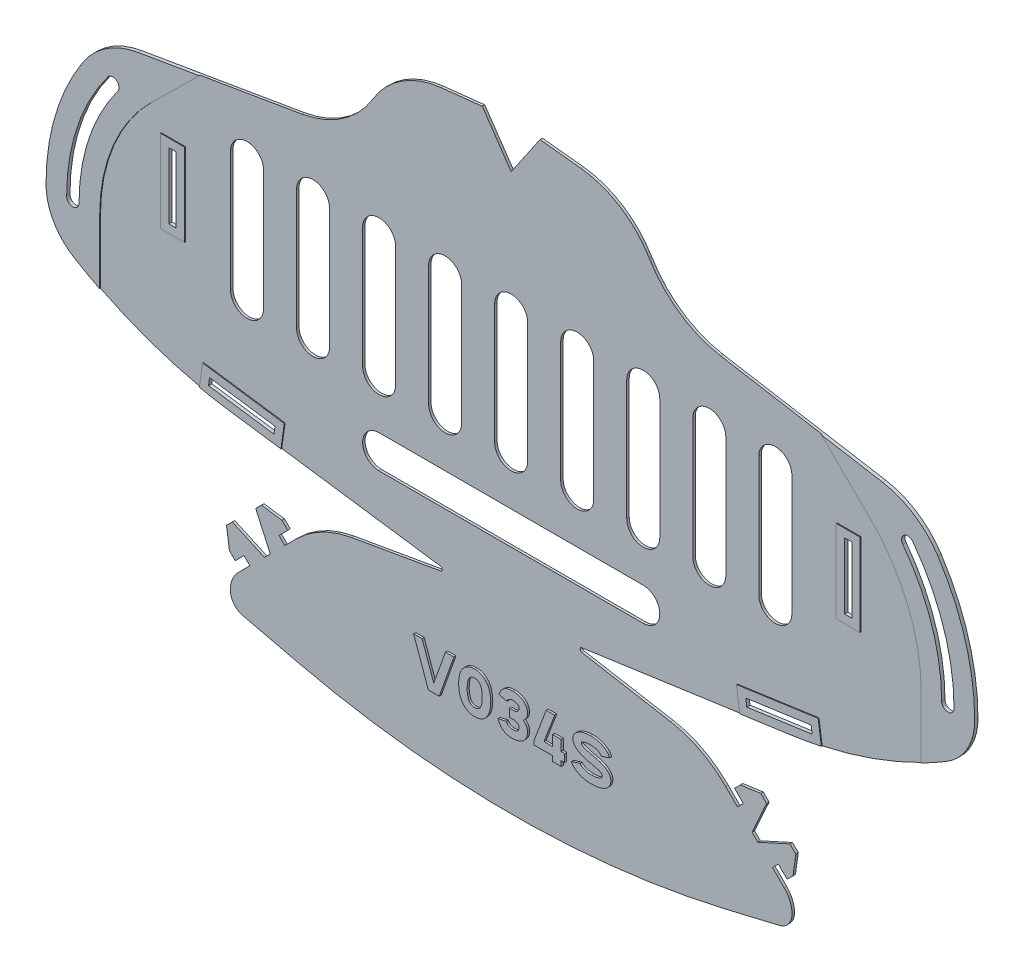
from build123d import *

# Parameters (mm, degrees)
MAIN_SHAPE_DEPTH                   = 0.6
ELASTIC_ATTACHMENT_POINTS_DEPTH    = 184.525502315
REINFORCED_ATTACHMENT_POINTS_DEPTH = 0.2
TAB_SLITS_DEPTH                    = 184.525502315
REINFORCED_TAB_SLITS_DEPTH         = 0.2
TAB_FLEX_RELIEF_DEPTH              = 184.525502315
TAB_FLEX_RELIEF_DEPTH_BACK         = 184.525502315
BREATHING_SLITS_DEPTH              = 184.525502315
VERSION_NUMBER_DEPTH               = 0.5
FILLET1_R                          = 0.5
TAB_OVERLAY_SLIT_DEPTH             = 184.525502394
TAB_OVERLAY_SLIT_DEPTH_BACK        = 184.525502394
SKETCH12_W                         = 1.8
SKETCH12_H                         = 16
SKETCH13_W                         = 5.8
SKETCH13_H                         = 20
SKETCH13_W_2                       = 1.8
SKETCH13_H_2                       = 16
TAB_OVERLAY_REINFORCEMENT_DEPTH    = 0.2


with BuildPart() as part:
    # Sketch1 → Main Shape (new body)
    with BuildSketch(Plane.XY):
        with BuildLine():
            Line((0, -10.235233266), (-7, 0))
            Line((-7, 0), (-16.941855461, -1.076805455))
            ThreePointArc((-16.941855461, -1.076805455), (-26.448172688, -4.42923559), (-33.461443341, -11.669600897))
            ThreePointArc((-33.461443341, -11.669600897), (-40.804108255, -19.481824954), (-50.74391922, -23.5))
            Line((-50.74391922, -23.5), (-90.180351554, -30.190874742))
            ThreePointArc((-90.180351554, -30.190874742), (-97.811505455, -33.190405434), (-103.597722286, -39))
            ThreePointArc((-103.597722286, -39), (-110.227482046, -53.35351039), (-112.5, -69))
            ThreePointArc((-112.5, -69), (-110.685143325, -75.893640703), (-105.711102551, -81))
            ThreePointArc((-105.711102551, -81), (-87.655491519, -89.524485559), (-68.266232563, -94.291935705))
            Line((-68.266232563, -94.291935705), (-14, -102))
            Line((-14, -102), (-38.626554922, -106.304973016))
            ThreePointArc((-38.626554922, -106.304973016), (-45.849449199, -108.748014338), (-52, -113.254607005))
            Line((-52, -113.254607005), (-54.828307349, -116.0831539))
            Line((-54.828307349, -116.0831539), (-56.242580797, -114.669000226))
            Line((-56.242580797, -114.669000226), (-54.121350285, -112.547590054))
            Line((-54.121350285, -112.547590054), (-55.535623732, -111.13343638))
            Line((-55.535623732, -111.13343638), (-60.48540114, -110.426539202))
            Line((-60.48540114, -110.426539202), (-68.970323187, -118.912179887))
            Line((-68.970323187, -118.912179887), (-68.263006804, -123.861897408))
            Line((-68.263006804, -123.861897408), (-66.848733357, -125.276051082))
            Line((-66.848733357, -125.276051082), (-64.727502845, -123.154640911))
            Line((-64.727502845, -123.154640911), (-63.313229397, -124.568794586))
            Line((-63.313229397, -124.568794586), (-66.141536747, -127.397341481))
            ThreePointArc((-66.141536747, -127.397341481), (-67.550417669, -129.506025763), (-68.045148042, -131.993340924))
            ThreePointArc((-68.045148042, -131.993340924), (-67.183295285, -134.473669911), (-64.9691321, -135.885159709))
            Line((-64.9691321, -135.885159709), (-52.436095294, -138.860716087))
            ThreePointArc((-52.436095294, -138.860716087), (-26.397134772, -143.459954927), (0, -145))
            ThreePointArc((0, -145), (26.397134772, -143.459954927), (52.436095294, -138.860716087))
            Line((52.436095294, -138.860716087), (64.9691321, -135.885159709))
            ThreePointArc((64.9691321, -135.885159709), (67.183295285, -134.473669911), (68.045148042, -131.993340924))
            ThreePointArc((68.045148042, -131.993340924), (67.550417669, -129.506025763), (66.141536747, -127.397341481))
            Line((66.141536747, -127.397341481), (63.313229397, -124.568794586))
            Line((63.313229397, -124.568794586), (64.727502845, -123.154640911))
            Line((64.727502845, -123.154640911), (66.848733357, -125.276051082))
            Line((66.848733357, -125.276051082), (68.263006804, -123.861897408))
            Line((68.263006804, -123.861897408), (68.970323187, -118.912179887))
            Line((68.970323187, -118.912179887), (60.48540114, -110.426539202))
            Line((60.48540114, -110.426539202), (55.535623732, -111.13343638))
            Line((55.535623732, -111.13343638), (54.121350285, -112.547590054))
            Line((54.121350285, -112.547590054), (56.242580797, -114.669000226))
            Line((56.242580797, -114.669000226), (54.828307349, -116.0831539))
            Line((54.828307349, -116.0831539), (52, -113.254607005))
            ThreePointArc((52, -113.254607005), (45.849449199, -108.748014338), (38.626554922, -106.304973016))
            Line((38.626554922, -106.304973016), (14, -102))
            Line((14, -102), (68.266232563, -94.291935705))
            ThreePointArc((68.266232563, -94.291935705), (87.655491519, -89.524485559), (105.711102551, -81))
            ThreePointArc((105.711102551, -81), (110.685143325, -75.893640703), (112.5, -69))
            ThreePointArc((112.5, -69), (110.227482046, -53.35351039), (103.597722286, -39))
            ThreePointArc((103.597722286, -39), (97.811505455, -33.190405434), (90.180351554, -30.190874742))
            Line((90.180351554, -30.190874742), (50.74391922, -23.5))
            ThreePointArc((50.74391922, -23.5), (40.804108255, -19.481824954), (33.461443341, -11.669600897))
            ThreePointArc((33.461443341, -11.669600897), (26.448172688, -4.42923559), (16.941855461, -1.076805455))
            Line((16.941855461, -1.076805455), (7, 0))
            Line((7, 0), (0, -10.235233266))
        make_face()
    extrude(amount=MAIN_SHAPE_DEPTH)

    # Sketch2 → Elastic Attachment Points (cut, through all)
    with BuildSketch(Plane.XY.offset(0.6)):
        with BuildLine():
            ThreePointArc((-97.5, -39), (-104.934164903, -53.188611699), (-107.5, -69))
            ThreePointArc((-107.5, -69), (-106, -70.5), (-104.5, -69))
            ThreePointArc((-104.5, -69), (-102.088115008, -54.137294997), (-95.1, -40.8))
            ThreePointArc((-95.1, -40.8), (-95.4, -38.7), (-97.5, -39))
        make_face()
        with BuildLine():
            ThreePointArc((97.5, -39), (104.934164903, -53.188611699), (107.5, -69))
            ThreePointArc((107.5, -69), (106, -70.5), (104.5, -69))
            ThreePointArc((104.5, -69), (102.088115008, -54.137294997), (95.1, -40.8))
            ThreePointArc((95.1, -40.8), (95.4, -38.7), (97.5, -39))
        make_face()
    extrude(amount=-ELASTIC_ATTACHMENT_POINTS_DEPTH, mode=Mode.SUBTRACT)

    # Sketch7 → Reinforced Attachment Points (add)
    # profile 1 of 2: a face of its own
    with BuildSketch(Plane.XY.offset(0.6)):
        with BuildLine():
            Line((-99.5, -69), (-99.5, -84.438405623))
            ThreePointArc((-99.5, -84.438405623), (-102.636073846, -82.774338486), (-105.711102551, -81))
            ThreePointArc((-105.711102551, -81), (-110.685143325, -75.893640703), (-112.5, -69))
            ThreePointArc((-112.5, -69), (-110.227482046, -53.35351039), (-103.597722286, -39))
            ThreePointArc((-103.597722286, -39), (-97.811505455, -33.190405434), (-90.180351554, -30.190874742))
            Line((-90.180351554, -30.190874742), (-75.331937335, -27.671659038))
            Line((-75.331937335, -27.671659038), (-86.893876913, -39))
            ThreePointArc((-86.893876913, -39), (-96.22042633, -52.729517991), (-99.5, -69))
        make_face()
        with BuildLine():
            ThreePointArc((-107.5, -69), (-106, -70.5), (-104.5, -69))
            ThreePointArc((-104.5, -69), (-102.088115008, -54.137294997), (-95.1, -40.8))
            ThreePointArc((-95.1, -40.8), (-95.4, -38.7), (-97.5, -39))
            ThreePointArc((-97.5, -39), (-104.934164903, -53.188611699), (-107.5, -69))
        make_face(mode=Mode.SUBTRACT)
    # profile 2 of 2: a face of its own
    with BuildSketch(Plane.XY.offset(0.6)):
        with BuildLine():
            Line((75.331937335, -27.671659038), (90.180351554, -30.190874742))
            ThreePointArc((90.180351554, -30.190874742), (97.811505455, -33.190405434), (103.597722286, -39))
            ThreePointArc((103.597722286, -39), (110.227482046, -53.35351039), (112.5, -69))
            ThreePointArc((112.5, -69), (110.685143325, -75.893640703), (105.711102551, -81))
            ThreePointArc((105.711102551, -81), (102.636073846, -82.774338486), (99.5, -84.438405623))
            Line((99.5, -84.438405623), (99.5, -69))
            ThreePointArc((99.5, -69), (96.22042633, -52.729517991), (86.893876913, -39))
            Line((86.893876913, -39), (75.331937335, -27.671659038))
        make_face()
        with BuildLine():
            ThreePointArc((104.5, -69), (106, -70.5), (107.5, -69))
            ThreePointArc((107.5, -69), (104.934164903, -53.188611699), (97.5, -39))
            ThreePointArc((97.5, -39), (95.4, -38.7), (95.1, -40.8))
            ThreePointArc((95.1, -40.8), (102.088115008, -54.137294997), (104.5, -69))
        make_face(mode=Mode.SUBTRACT)
    extrude(amount=REINFORCED_ATTACHMENT_POINTS_DEPTH)

    # Sketch6 → Tab Slits (cut, through all)
    with BuildSketch(Plane.XY.offset(0.6)):
        Polygon((-73.122472744, -91.582072346), (-57.281477317, -93.832153206), (-57.02834322, -92.050041221), (-72.869338647, -89.79996036), align=None)
        Polygon((73.122472744, -91.582072346), (72.869338647, -89.79996036), (57.02834322, -92.050041221), (57.281477317, -93.832153206), align=None)
    extrude(amount=-TAB_SLITS_DEPTH, mode=Mode.SUBTRACT)

    # Sketch9 → Reinforced Tab Slits (add)
    # profile 1 of 2: a face of its own
    with BuildSketch(Plane.XY.offset(0.6)):
        with BuildLine():
            Line((-55.582612996, -96.093537742), (-54.766958684, -90.3511769))
            Line((-54.766958684, -90.3511769), (-74.568202968, -87.538575825))
            Line((-74.568202968, -87.538575825), (-75.347469499, -93.024759795))
            ThreePointArc((-75.347469499, -93.024759795), (-71.81824936, -93.72204393), (-68.266232563, -94.291935705))
            Line((-68.266232563, -94.291935705), (-55.582612996, -96.093537742))
        make_face()
        Polygon((-57.281477317, -93.832153206), (-57.02834322, -92.050041221), (-72.869338647, -89.79996036), (-73.122472744, -91.582072346), align=None, mode=Mode.SUBTRACT)
    # profile 2 of 2: a face of its own
    with BuildSketch(Plane.XY.offset(0.6)):
        with BuildLine():
            Line((68.266232563, -94.291935705), (55.582612996, -96.093537742))
            Line((55.582612996, -96.093537742), (54.766958684, -90.3511769))
            Line((54.766958684, -90.3511769), (74.568202968, -87.538575825))
            Line((74.568202968, -87.538575825), (75.347469499, -93.024759795))
            ThreePointArc((75.347469499, -93.024759795), (71.81824936, -93.72204393), (68.266232563, -94.291935705))
        make_face()
        Polygon((57.02834322, -92.050041221), (72.869338647, -89.79996036), (73.122472744, -91.582072346), (57.281477317, -93.832153206), align=None, mode=Mode.SUBTRACT)
    extrude(amount=REINFORCED_TAB_SLITS_DEPTH)

    # Sketch11 → Tab Flex Relief (cut, two sides: drawn at the far end of the back side and taken through both)
    with BuildSketch(Plane.XY.offset(0.6).offset(-TAB_FLEX_RELIEF_DEPTH_BACK)):
        Polygon((-67.556169513, -117.49790644), (-59.777845211, -121.033110967), (-58.363691536, -119.618837519), (-61.899554814, -111.840812649), align=None)
        Polygon((61.899554814, -111.840812649), (67.556169513, -117.49790644), (59.777845211, -121.033110967), (58.363691536, -119.618837519), align=None)
    extrude(amount=TAB_FLEX_RELIEF_DEPTH + TAB_FLEX_RELIEF_DEPTH_BACK, mode=Mode.SUBTRACT)

    # Sketch3 → Breathing Slits (cut, through all)
    with BuildSketch(Plane.XY.offset(0.6)):
        with BuildLine():
            Line((4, -39.9), (4, -69))
            ThreePointArc((4, -69), (0, -73), (-4, -69))
            Line((-4, -69), (-4, -39.9))
            ThreePointArc((-4, -39.9), (0, -35.9), (4, -39.9))
        make_face()
        with BuildLine():
            Line((-12, -39.9), (-12, -69))
            ThreePointArc((-12, -69), (-16, -73), (-20, -69))
            Line((-20, -69), (-20, -39.9))
            ThreePointArc((-20, -39.9), (-16, -35.9), (-12, -39.9))
        make_face()
        with BuildLine():
            Line((-28, -39.9), (-28, -69))
            ThreePointArc((-28, -69), (-32, -73), (-36, -69))
            Line((-36, -69), (-36, -39.9))
            ThreePointArc((-36, -39.9), (-32, -35.9), (-28, -39.9))
        make_face()
        with BuildLine():
            Line((-32, -81), (32, -81))
            ThreePointArc((32, -81), (36, -85), (32, -89))
            Line((32, -89), (-32, -89))
            ThreePointArc((-32, -89), (-36, -85), (-32, -81))
        make_face()
        with BuildLine():
            Line((-44, -39.9), (-44, -69))
            ThreePointArc((-44, -69), (-48, -73), (-52, -69))
            Line((-52, -69), (-52, -39.9))
            ThreePointArc((-52, -39.9), (-48, -35.9), (-44, -39.9))
        make_face()
        with BuildLine():
            Line((-60, -39.9), (-60, -69))
            ThreePointArc((-60, -69), (-64, -73), (-68, -69))
            Line((-68, -69), (-68, -39.9))
            ThreePointArc((-68, -39.9), (-64, -35.9), (-60, -39.9))
        make_face()
        with BuildLine():
            Line((12, -39.9), (12, -69))
            ThreePointArc((12, -69), (16, -73), (20, -69))
            Line((20, -69), (20, -39.9))
            ThreePointArc((20, -39.9), (16, -35.9), (12, -39.9))
        make_face()
        with BuildLine():
            Line((28, -39.9), (28, -69))
            ThreePointArc((28, -69), (32, -73), (36, -69))
            Line((36, -69), (36, -39.9))
            ThreePointArc((36, -39.9), (32, -35.9), (28, -39.9))
        make_face()
        with BuildLine():
            Line((44, -39.9), (44, -69))
            ThreePointArc((44, -69), (48, -73), (52, -69))
            Line((52, -69), (52, -39.9))
            ThreePointArc((52, -39.9), (48, -35.9), (44, -39.9))
        make_face()
        with BuildLine():
            Line((60, -39.9), (60, -69))
            ThreePointArc((60, -69), (64, -73), (68, -69))
            Line((68, -69), (68, -39.9))
            ThreePointArc((68, -39.9), (64, -35.9), (60, -39.9))
        make_face()
    extrude(amount=-BREATHING_SLITS_DEPTH, mode=Mode.SUBTRACT)

    # Sketch8 → Version Number (add)
    # profile 1 of 5: a face of its own
    with BuildSketch(Plane.XY.offset(0.6)):
        Polygon((-19.57047323, -128.5), (-16.935552595, -128.5), (-13.364124024, -118.5), (-15.427616087, -118.5), (-18.253012913, -126.420634921), (-21.078409738, -118.5), (-23.141901802, -118.5), align=None)
    # profile 2 of 5: a face of its own
    with BuildSketch(Plane.XY.offset(0.6)):
        with BuildLine():
            add(Edge.make_bspline(
                [(-8.341949344, -118.5), (-8.486315308, -118.505695671), (-8.769070456, -118.51685121), (-9.182205457, -118.5745591), (-9.57004816, -118.680335178), (-9.937249736, -118.819656178), (-10.279525307, -119.003303471), (-10.603318482, -119.221085059), (-10.896329097, -119.487440084), (-11.17178415, -119.785519386), (-11.417647331, -120.12453761), (-11.63108304, -120.500892889), (-11.813045817, -120.912503383), (-11.961966981, -121.360169436), (-12.077516029, -121.844506854), (-12.165269968, -122.364485904), (-12.216824407, -122.921030718), (-12.227481137, -123.303893775), (-12.232959719, -123.500722112)],
                knots=[0, 0, 0, 0, 0.970159994, 1.900155169, 2.79438565, 3.665191596, 4.532301255, 5.397946305, 6.279238358, 7.185391655, 8.120220805, 9.085107467, 10.08639026, 11.138349125, 12.249459105, 13.427760297, 14.677622047, 16, 16, 16, 16], degree=3))
            add(Edge.make_bspline(
                [(-12.232959719, -123.500722112), (-12.227536328, -123.69832053), (-12.217027701, -124.081196856), (-12.165060632, -124.637697099), (-12.077614742, -125.156966907), (-11.961504885, -125.641884177), (-11.813562222, -126.090648826), (-11.631015597, -126.502814664), (-11.417705293, -126.879260377), (-11.171624113, -127.218032326), (-10.897232375, -127.51659595), (-10.601764829, -127.779877259), (-10.280413586, -128.000979952), (-9.937056282, -128.183632701), (-9.570503227, -128.324409639), (-9.181550148, -128.425104033), (-8.769771827, -128.488808035), (-8.486990454, -128.496221224), (-8.342846378, -128.5)],
                knots=[0, 0, 0, 0, 1.327400251, 2.57203543, 3.750234214, 4.861247624, 5.917991082, 6.919186852, 7.883989653, 8.818737555, 9.724812096, 10.602616666, 11.47109776, 12.338132057, 13.208862319, 14.101698703, 15.032365954, 16, 16, 16, 16], degree=3))
            add(Edge.make_bspline(
                [(-8.342846378, -128.5), (-8.19870671, -128.496210687), (-7.91593398, -128.488776824), (-7.504093566, -128.425221319), (-7.114671235, -128.323813307), (-6.747309757, -128.184839888), (-6.404920278, -128.000200623), (-6.083873871, -127.779984633), (-5.788475203, -127.516566079), (-5.514065403, -127.218040576), (-5.267984776, -126.879258594), (-5.054692034, -126.502813072), (-4.872070157, -126.090657611), (-4.724432419, -125.641847927), (-4.607119569, -125.157235462), (-4.524677423, -124.637275213), (-4.467021197, -124.081441513), (-4.459110829, -123.698369528), (-4.455029445, -123.500722112)],
                knots=[0, 0, 0, 0, 0.96765053, 1.898333634, 2.791185227, 3.666728435, 4.529238626, 5.397734515, 6.275554038, 7.181644014, 8.116407839, 9.081227075, 10.082439899, 11.139201358, 12.250233695, 13.427610983, 14.672766316, 16, 16, 16, 16], degree=3))
            add(Edge.make_bspline(
                [(-4.455029445, -123.500722112), (-4.459170275, -123.303845261), (-4.46722698, -122.920787111), (-4.524470959, -122.364907693), (-4.607219153, -121.844238468), (-4.723968789, -121.360205444), (-4.872586754, -120.912494629), (-5.054624571, -120.500894477), (-5.268042748, -120.124539393), (-5.513905343, -119.785511139), (-5.78937858, -119.487469991), (-6.082319788, -119.220977415), (-6.40580465, -119.004075275), (-6.747116298, -118.818455332), (-7.115126862, -118.680915067), (-7.503443494, -118.574534625), (-7.916292572, -118.516562336), (-8.198777403, -118.506550382), (-8.342846378, -118.501444225)],
                knots=[0, 0, 0, 0, 1.322391154, 2.572941942, 3.750582404, 4.861863084, 5.913983562, 6.915420183, 7.880455081, 8.815427849, 9.721720359, 10.603147806, 11.468925845, 12.331628829, 13.207367743, 14.101735605, 15.031873656, 16, 16, 16, 16], degree=3))
            Line((-8.342846378, -118.501444225), (-8.341949344, -118.5))
        make_face()
        with BuildLine():
            add(Edge.make_bspline(
                [(-8.341949344, -126.579365079), (-8.411268892, -126.580142247), (-8.547279218, -126.581667111), (-8.744732455, -126.549518886), (-8.93118355, -126.50001124), (-9.105360845, -126.424863461), (-9.269156206, -126.32888552), (-9.419771749, -126.207295998), (-9.558130772, -126.063513987), (-9.68544583, -125.896932623), (-9.799317133, -125.703005633), (-9.897848122, -125.478827118), (-9.978585537, -125.222713054), (-10.047762295, -124.937433189), (-10.09901366, -124.621763618), (-10.137517225, -124.276117752), (-10.163383889, -123.899148475), (-10.166743164, -123.63702081), (-10.168489888, -123.500722112)],
                knots=[0, 0, 0, 0, 0.820209436, 1.609314487, 2.362064528, 3.101854642, 3.850272983, 4.605479342, 5.3882482, 6.210255141, 7.084711649, 8.047345167, 9.106040688, 10.263495908, 11.523832392, 12.893430008, 14.384674726, 16, 16, 16, 16], degree=3))
            add(Edge.make_bspline(
                [(-10.168489888, -123.500722112), (-10.166736277, -123.364424703), (-10.163363758, -123.102299516), (-10.137588113, -122.725313211), (-10.098695139, -122.378974061), (-10.048398855, -122.063111109), (-9.978181432, -121.778059679), (-9.8978784, -121.522619394), (-9.79934824, -121.298401339), (-9.685313581, -121.104640769), (-9.558923277, -120.937923887), (-9.418960791, -120.796456824), (-9.269240039, -120.674830172), (-9.105400155, -120.578630118), (-8.930754135, -120.50465551), (-8.745386588, -120.450210023), (-8.547242879, -120.423926373), (-8.411799607, -120.422146526), (-8.342846378, -120.421240419)],
                knots=[0, 0, 0, 0, 1.616177311, 3.108208617, 4.478528655, 5.748482895, 6.897727805, 7.956981757, 8.920123036, 9.795040793, 10.617481319, 11.394165711, 12.149770419, 12.898583529, 13.63876386, 14.394368568, 15.182584207, 16, 16, 16, 16], degree=3))
            add(Edge.make_bspline(
                [(-8.342846378, -120.421240419), (-8.273894743, -120.422149219), (-8.138454599, -120.423934355), (-7.940288378, -120.450179948), (-7.755001791, -120.504762296), (-7.580668444, -120.577982734), (-7.418443109, -120.675595023), (-7.268973351, -120.796360516), (-7.129073104, -120.937948802), (-7.002708792, -121.104645093), (-6.888484055, -121.298351736), (-6.790698774, -121.523063414), (-6.706738916, -121.777554553), (-6.637549817, -122.063195246), (-6.586920138, -122.378948588), (-6.548128024, -122.725320897), (-6.52232236, -123.102297333), (-6.518954209, -123.364423957), (-6.517202869, -123.500722112)],
                knots=[0, 0, 0, 0, 0.817669415, 1.606129616, 2.361968767, 3.102378757, 3.843623451, 4.599462602, 5.376387978, 6.199083685, 7.074272906, 8.037713021, 9.100132017, 10.249733507, 11.520081779, 12.89082699, 14.383321233, 16, 16, 16, 16], degree=3))
            add(Edge.make_bspline(
                [(-6.517202869, -123.500722112), (-6.518947322, -123.637021556), (-6.52230223, -123.899150658), (-6.548198906, -124.276110066), (-6.586601856, -124.621789015), (-6.638185075, -124.937349474), (-6.70632694, -125.223220708), (-6.790728452, -125.478383327), (-6.888515307, -125.703055181), (-7.002576486, -125.896928348), (-7.129865628, -126.063488884), (-7.268161719, -126.207393621), (-7.418525808, -126.328120602), (-7.580707035, -126.425517476), (-7.754572285, -126.499891817), (-7.940941623, -126.549600883), (-8.138131252, -126.581404352), (-8.273829787, -126.580608552), (-8.342846378, -126.580203806)],
                knots=[0, 0, 0, 0, 1.616177474, 3.108208932, 4.478529109, 5.739530511, 6.897596372, 7.959685938, 8.922827315, 9.797745161, 10.620185771, 11.403367596, 12.15897238, 12.899987232, 13.640167639, 14.39331481, 15.182836171, 16, 16, 16, 16], degree=3))
            Line((-8.342846378, -126.580203806), (-8.341949344, -126.579365079))
        make_face(mode=Mode.SUBTRACT)
    # profile 3 of 5: a face of its own
    with BuildSketch(Plane.XY.offset(0.6)):
        with BuildLine():
            Line((0.980655463, -124.404761905), (1.075893558, -124.404761905))
            add(Edge.make_bspline(
                [(1.075893558, -124.404761905), (1.176161453, -124.411299477), (1.366796655, -124.423729091), (1.633462951, -124.486416557), (1.86625704, -124.578961335), (2.057944418, -124.709274647), (2.211589719, -124.861365804), (2.325917158, -125.032278467), (2.395578402, -125.222537651), (2.404453839, -125.355662585), (2.40893087, -125.422814713)],
                knots=[0, 0, 0, 0, 1.293250512, 2.458803691, 3.516087315, 4.504014474, 5.424976382, 6.287022232, 7.135923681, 8, 8, 8, 8], degree=3))
            add(Edge.make_bspline(
                [(2.40893087, -125.422814713), (2.40564132, -125.504440638), (2.399280334, -125.662280257), (2.330132962, -125.887718235), (2.211778105, -126.087113891), (2.076862268, -126.23073656), (1.947697612, -126.331172702), (1.832808617, -126.395688771), (1.703957717, -126.450185226), (1.560929711, -126.49595932), (1.404208252, -126.532200484), (1.233249315, -126.560253509), (1.047425593, -126.575366879), (0.918586597, -126.5785552), (0.851966971, -126.580203806)],
                knots=[0, 0, 0, 0, 1.334208421, 2.579951764, 3.816761299, 5.103436918, 5.78324123, 6.491044783, 7.25516555, 8.072210043, 8.94833879, 9.888551629, 10.908219533, 12, 12, 12, 12], degree=3))
            add(Edge.make_bspline(
                [(0.851966971, -126.580203806), (0.77757338, -126.579024673), (0.627088787, -126.576639503), (0.400442241, -126.537785365), (0.172167283, -126.472292557), (-0.054930116, -126.384048723), (-0.269086717, -126.26078738), (-0.446409245, -126.088542309), (-0.587579001, -125.87591894), (-0.642148155, -125.712337396), (-0.670550824, -125.62719493)],
                knots=[0, 0, 0, 0, 0.920255672, 1.861508472, 2.836752399, 3.857684402, 4.873720033, 5.872631744, 6.892727297, 8, 8, 8, 8], degree=3))
            Line((-0.670550824, -125.62719493), (-2.654265172, -126.071428571))
            add(Edge.make_bspline(
                [(-2.654265172, -126.071428571), (-2.631429888, -126.160336196), (-2.586473743, -126.335369884), (-2.493464864, -126.586847228), (-2.382027426, -126.824009097), (-2.256871083, -127.050933458), (-2.108719996, -127.26169635), (-1.944551457, -127.459934114), (-1.765319927, -127.647890635), (-1.564987635, -127.819546753), (-1.347540657, -127.976110236), (-1.110394083, -128.112422888), (-0.855828585, -128.230322428), (-0.580291195, -128.322934743), (-0.28817358, -128.399729339), (0.023094989, -128.45295857), (0.351925968, -128.491934936), (0.57780746, -128.497268097), (0.693514893, -128.5)],
                knots=[0, 0, 0, 0, 0.97897001, 1.927311989, 2.855460552, 3.773345826, 4.68872018, 5.599601379, 6.518067916, 7.456260856, 8.41049365, 9.372940738, 10.370680865, 11.39871829, 12.470472684, 13.590411754, 14.765692276, 16, 16, 16, 16], degree=3))
            add(Edge.make_bspline(
                [(0.693514893, -128.5), (0.849784779, -128.494245394), (1.152310829, -128.483104934), (1.590119618, -128.435865678), (1.995768, -128.358387224), (2.369542792, -128.252017359), (2.714416486, -128.123277608), (3.025401906, -127.961059217), (3.307493342, -127.774497038), (3.555147363, -127.55815064), (3.769542076, -127.319870658), (3.96129965, -127.071551477), (4.119088942, -126.805353082), (4.251619596, -126.527874631), (4.35024722, -126.234513517), (4.421710923, -125.928607165), (4.463383325, -125.607680152), (4.468500958, -125.38925418), (4.471104294, -125.278141077)],
                knots=[0, 0, 0, 0, 1.338573179, 2.591371041, 3.766159492, 4.869841347, 5.915366975, 6.911991706, 7.866279139, 8.804635322, 9.718527085, 10.607232931, 11.486170613, 12.362759498, 13.235296616, 14.130311397, 15.048891017, 16, 16, 16, 16], degree=3))
            add(Edge.make_bspline(
                [(4.471104294, -125.278141077), (4.465755867, -125.181448476), (4.455229107, -124.991138356), (4.399913522, -124.713321084), (4.307553634, -124.451246621), (4.178361896, -124.20784025), (4.02716219, -123.977552327), (3.852030774, -123.764837772), (3.657633728, -123.566155092), (3.513209062, -123.449574998), (3.440017582, -123.39049458)],
                knots=[0, 0, 0, 0, 1.042147361, 2.051151675, 3.039496243, 4.024119517, 5.012016893, 6.002285516, 6.987598979, 8, 8, 8, 8], degree=3))
            add(Edge.make_bspline(
                [(3.440017582, -123.39049458), (3.513198617, -123.325162044), (3.657559373, -123.19628365), (3.851831496, -122.981710509), (4.026002201, -122.755542958), (4.179357953, -122.515248899), (4.306559478, -122.261642739), (4.399383567, -121.993228321), (4.45529183, -121.711764564), (4.465777218, -121.519933272), (4.471104294, -121.42247384)],
                knots=[0, 0, 0, 0, 1.026734164, 2.025389794, 3.025877614, 4.013273499, 5.006315215, 5.989929209, 6.978788314, 8, 8, 8, 8], degree=3))
            add(Edge.make_bspline(
                [(4.471104294, -121.42247384), (4.467022429, -121.322020203), (4.459003449, -121.124675201), (4.412060752, -120.835115028), (4.336882737, -120.558271626), (4.22944068, -120.294880847), (4.096025084, -120.042407113), (3.93121317, -119.803370965), (3.740183992, -119.574583887), (3.519353133, -119.361344215), (3.272653975, -119.166999953), (3.000845759, -118.995833154), (2.706307069, -118.84746887), (2.385531016, -118.730513446), (2.043615399, -118.632405283), (1.677735563, -118.562780212), (1.288660408, -118.515976725), (1.021272317, -118.506371293), (0.884116668, -118.501444225)],
                knots=[0, 0, 0, 0, 0.933249724, 1.833404674, 2.71837752, 3.592513965, 4.4704886, 5.365912677, 6.284554944, 7.234984132, 8.212272519, 9.196674926, 10.214289296, 11.269589965, 12.363543901, 13.515449053, 14.72555956, 16, 16, 16, 16], degree=3))
            add(Edge.make_bspline(
                [(0.884116668, -118.501444225), (0.770724316, -118.504384419), (0.549543557, -118.510119502), (0.226759287, -118.546209564), (-0.079070018, -118.597359567), (-0.367888744, -118.671164203), (-0.638932301, -118.76520159), (-0.892654384, -118.877770477), (-1.129183918, -119.009217236), (-1.346787187, -119.161041577), (-1.547047763, -119.328960798), (-1.728444751, -119.510905494), (-1.893191745, -119.704452098), (-2.03772592, -119.91288512), (-2.167355396, -120.132286581), (-2.273890425, -120.36651166), (-2.368809383, -120.610059019), (-2.412213601, -120.780460499), (-2.434191346, -120.866743363)],
                knots=[0, 0, 0, 0, 1.229240767, 2.397731417, 3.51786287, 4.588673614, 5.625367482, 6.624717489, 7.594406979, 8.554388623, 9.496885304, 10.424058211, 11.336820069, 12.248524965, 13.170856983, 14.095351914, 15.035580601, 16, 16, 16, 16], degree=3))
            Line((-2.434191346, -120.866743363), (-0.527281045, -121.373015873))
            add(Edge.make_bspline(
                [(-0.527281045, -121.373015873), (-0.515983395, -121.326631527), (-0.491467219, -121.22597637), (-0.400966092, -121.081457089), (-0.279117418, -120.927147787), (-0.117904643, -120.771324055), (0.07947313, -120.625559671), (0.317563108, -120.514206488), (0.590647495, -120.446844288), (0.783476933, -120.430020784), (0.884116668, -120.421240419)],
                knots=[0, 0, 0, 0, 0.626586808, 1.359708585, 2.222843852, 3.223153095, 4.308434095, 5.447412619, 6.667777482, 8, 8, 8, 8], degree=3))
            add(Edge.make_bspline(
                [(0.884116668, -120.421240419), (0.956149654, -120.423218633), (1.094385143, -120.42701494), (1.291788465, -120.449676308), (1.472080093, -120.474391788), (1.633129498, -120.515621967), (1.778744505, -120.558109891), (1.903353692, -120.618078056), (2.014115026, -120.680273756), (2.129018714, -120.780934624), (2.243346705, -120.912654377), (2.346340657, -121.077310889), (2.406337672, -121.24921056), (2.40807674, -121.365405566), (2.40893087, -121.42247384)],
                knots=[0, 0, 0, 0, 1.26888152, 2.435057415, 3.499383416, 4.470882074, 5.362320585, 6.164854387, 6.902680001, 7.591682225, 8.843898063, 9.963361673, 10.999720905, 12, 12, 12, 12], degree=3))
            add(Edge.make_bspline(
                [(2.40893087, -121.42247384), (2.403860116, -121.49199044), (2.393781918, -121.630155711), (2.318503105, -121.827940252), (2.196977792, -122.008163808), (2.033651046, -122.171288708), (1.826315137, -122.307565764), (1.578778162, -122.408872593), (1.291897828, -122.47003825), (1.088042985, -122.480300003), (0.980565759, -122.485710249)],
                knots=[0, 0, 0, 0, 0.842573162, 1.674626639, 2.532888499, 3.465967991, 4.458251597, 5.524776888, 6.695002246, 8, 8, 8, 8], degree=3))
            Line((0.980565759, -122.485710249), (0.123512606, -122.484126984))
            Line((0.123512606, -122.484126984), (0.123512606, -124.404761905))
            Line((0.123512606, -124.404761905), (0.980655463, -124.404761905))
        make_face()
    # profile 4 of 5: a face of its own
    with BuildSketch(Plane.XY.offset(0.6)):
        Polygon((10.564875738, -128.5), (12.628367802, -128.5), (12.628367802, -127.246031746), (13.453764627, -127.246031746), (13.453764627, -125.325396825), (12.628367802, -125.325396825), (12.628367802, -122.785714286), (10.564875738, -122.785714286), (10.564875738, -125.325396825), (8.453764627, -125.325396825), (11.05693923, -118.5), (8.993447167, -118.5), (5.993447167, -126.388888889), (5.993447167, -127.246031746), (10.564875738, -127.246031746), align=None)
    # profile 5 of 5: a face of its own
    with BuildSketch(Plane.XY.offset(0.6)):
        with BuildLine():
            add(Edge.make_bspline(
                [(24.649385307, -125.531746032), (24.646498355, -125.436285182), (24.640812189, -125.248264664), (24.590880282, -124.971573191), (24.50864328, -124.706487636), (24.390259438, -124.453940642), (24.235891881, -124.214454259), (24.047006597, -123.987830994), (23.82402501, -123.772935761), (23.567094256, -123.570035613), (23.272262195, -123.378876225), (22.938957063, -123.197945262), (22.564667301, -123.029686218), (22.15388131, -122.866007919), (21.702866619, -122.715136729), (21.21170818, -122.576683253), (20.682380913, -122.442048846), (20.313593333, -122.366313826), (20.123413932, -122.327258171)],
                knots=[0, 0, 0, 0, 0.761030942, 1.498933149, 2.234785869, 2.969649761, 3.716667643, 4.501656281, 5.31785169, 6.182843945, 7.109303426, 8.117634967, 9.205209993, 10.38112034, 11.64403038, 12.997003453, 14.451390136, 16, 16, 16, 16], degree=3))
            add(Edge.make_bspline(
                [(20.123413932, -122.327258171), (20.017669521, -122.30555769), (19.811877981, -122.263325903), (19.514415638, -122.193679101), (19.236619973, -122.126464334), (18.98073366, -122.053760118), (18.743562243, -121.983655528), (18.526958807, -121.910448671), (18.330339887, -121.837446954), (18.154822926, -121.761475107), (17.999366076, -121.683760331), (17.862489689, -121.606491372), (17.747400538, -121.52614758), (17.651577717, -121.445158589), (17.57455839, -121.363937692), (17.520500128, -121.278672354), (17.482956247, -121.192692147), (17.476519171, -121.132708689), (17.473360334, -121.103273277)],
                knots=[0, 0, 0, 0, 1.70301331, 3.314271901, 4.819820312, 6.211652842, 7.510691048, 8.721335644, 9.818207508, 10.818842107, 11.737003788, 12.55938616, 13.296472535, 13.947505605, 14.537298364, 15.05322349, 15.535392622, 16, 16, 16, 16], degree=3))
            add(Edge.make_bspline(
                [(17.473360334, -121.103273277), (17.477116051, -121.073730175), (17.484612362, -121.014762936), (17.525161546, -120.933320131), (17.578350882, -120.85502718), (17.653130066, -120.785136217), (17.744897821, -120.719416618), (17.855937459, -120.661024774), (17.984600938, -120.605450636), (18.186135081, -120.54205361), (18.462243364, -120.471543352), (18.821457923, -120.416791975), (19.20860317, -120.378194754), (19.477251943, -120.374778885), (19.615908, -120.373015873)],
                knots=[0, 0, 0, 0, 0.442404219, 0.883026937, 1.343578875, 1.853695657, 2.403394497, 3.028419639, 3.725998545, 4.497210486, 6.185586065, 7.98320576, 9.92683641, 12, 12, 12, 12], degree=3))
            add(Edge.make_bspline(
                [(19.615908, -120.373015873), (19.794499981, -120.37729896), (20.13447088, -120.38545232), (20.617511049, -120.449603007), (21.050075404, -120.541532724), (21.372062737, -120.657530966), (21.599946148, -120.764382868), (21.748911489, -120.847850049), (21.878690448, -120.939830039), (21.995110023, -121.031429053), (22.089388787, -121.134653096), (22.168558233, -121.23996742), (22.230163744, -121.351062201), (22.255674217, -121.429640789), (22.268258005, -121.468401979)],
                knots=[0, 0, 0, 0, 2.116454478, 4.028920736, 5.76824916, 7.349955427, 8.072555538, 8.751313014, 9.370620762, 9.95742532, 10.503217928, 11.022328702, 11.517735004, 12, 12, 12, 12], degree=3))
            Line((22.268258005, -121.468401979), (24.33192499, -120.801587302))
            add(Edge.make_bspline(
                [(24.33192499, -120.801587302), (24.305114146, -120.723709964), (24.250734765, -120.565754422), (24.130139058, -120.341160489), (23.986464537, -120.121644367), (23.808679386, -119.913174822), (23.600788471, -119.714727676), (23.365859496, -119.51991866), (23.098486795, -119.338111599), (22.805358126, -119.163651092), (22.488756796, -119.004001168), (22.151984658, -118.864827802), (21.799510515, -118.740627556), (21.426976014, -118.644853053), (21.038928394, -118.562439083), (20.632772239, -118.507359035), (20.209916686, -118.466483143), (19.921429051, -118.457698188), (19.774360078, -118.453219679)],
                knots=[0, 0, 0, 0, 0.726103589, 1.472727363, 2.243106217, 3.039201532, 3.885168805, 4.778176173, 5.730487181, 6.736533093, 7.788322898, 8.857683223, 9.951973907, 11.084718459, 12.251095641, 13.452483767, 14.701294093, 16, 16, 16, 16], degree=3))
            add(Edge.make_bspline(
                [(19.774360078, -118.453219679), (19.612759798, -118.458420382), (19.29743402, -118.468568357), (18.837122206, -118.511672061), (18.402745557, -118.581550523), (17.992286784, -118.669148997), (17.608451119, -118.783931561), (17.250103881, -118.922594816), (16.916390943, -119.081942833), (16.61188275, -119.266301303), (16.336441204, -119.463936656), (16.096530971, -119.676395626), (15.890151844, -119.89660328), (15.720508314, -120.127529061), (15.587715293, -120.369247363), (15.490449504, -120.620779741), (15.428989771, -120.883067537), (15.41714763, -121.061622507), (15.41118691, -121.151497822)],
                knots=[0, 0, 0, 0, 1.377469995, 2.687815851, 3.935975333, 5.124495959, 6.261503082, 7.345570081, 8.395751581, 9.408063538, 10.37480451, 11.280450556, 12.134282462, 12.941818463, 13.715344344, 14.477233427, 15.233518248, 16, 16, 16, 16], degree=3))
            add(Edge.make_bspline(
                [(15.41118691, -121.151497822), (15.420035926, -121.251403731), (15.437593583, -121.449630736), (15.510119222, -121.738159073), (15.620898495, -122.013403807), (15.775768723, -122.270337272), (15.962002455, -122.517689843), (16.193945369, -122.744618604), (16.460046749, -122.960971045), (16.764133687, -123.157964072), (17.093487898, -123.342173451), (17.442543493, -123.514030242), (17.808794589, -123.672790245), (18.1917175, -123.817702921), (18.592677796, -123.944781076), (19.007884639, -124.063140325), (19.441041705, -124.164162133), (19.736621806, -124.2191172), (19.886884018, -124.247054365)],
                knots=[0, 0, 0, 0, 0.821760829, 1.630486029, 2.430435666, 3.246780216, 4.084509209, 4.963694347, 5.90126642, 6.89401515, 7.931513956, 8.995878504, 10.084293625, 11.205122729, 12.352962801, 13.533823192, 14.746285084, 16, 16, 16, 16], degree=3))
            add(Edge.make_bspline(
                [(19.886884018, -124.247054365), (20.013273753, -124.271104092), (20.255735287, -124.317240226), (20.602606824, -124.390568434), (20.917969637, -124.464331664), (21.203430619, -124.536473727), (21.456385701, -124.612600111), (21.679536027, -124.684901781), (21.870123725, -124.760879191), (22.033521328, -124.836201027), (22.169980228, -124.915482438), (22.287555266, -124.994146041), (22.38620762, -125.075656688), (22.465811093, -125.160851516), (22.525289778, -125.250010311), (22.564082561, -125.342038798), (22.587024105, -125.437002093), (22.585787832, -125.500769755), (22.585162161, -125.533042246)],
                knots=[0, 0, 0, 0, 1.946246532, 3.733609547, 5.36272598, 6.845647735, 8.18659192, 9.358372485, 10.392664873, 11.288799933, 12.077323831, 12.777487233, 13.426878789, 14.008750178, 14.535466235, 15.03874927, 15.513515881, 16, 16, 16, 16], degree=3))
            add(Edge.make_bspline(
                [(22.585162161, -125.533042246), (22.579962729, -125.572493894), (22.569580368, -125.651271957), (22.522896434, -125.763941753), (22.455770839, -125.870720239), (22.364205055, -125.969216515), (22.25228829, -126.063010343), (22.115250398, -126.145729121), (21.958665712, -126.227189486), (21.714962824, -126.325186148), (21.37731395, -126.425017755), (20.94272759, -126.515184705), (20.472932404, -126.567070193), (20.148799843, -126.575724531), (19.981036702, -126.580203806)],
                knots=[0, 0, 0, 0, 0.475442435, 0.949375666, 1.448598243, 1.981544609, 2.555163518, 3.194514629, 3.896631431, 4.670633754, 6.340509376, 8.112188439, 9.987763167, 12, 12, 12, 12], degree=3))
            add(Edge.make_bspline(
                [(19.981036702, -126.580203806), (19.800845039, -126.572109733), (19.452692435, -126.55647098), (18.952508681, -126.478725016), (18.492269894, -126.367563715), (18.142733819, -126.232821617), (17.892714707, -126.111220303), (17.72728281, -126.024811322), (17.585518879, -125.934962582), (17.463583394, -125.84775563), (17.359537159, -125.764139055), (17.282362383, -125.675742049), (17.220487309, -125.591210672), (17.198829346, -125.529855009), (17.188605875, -125.500892549)],
                knots=[0, 0, 0, 0, 2.085601758, 4.029640844, 5.846941631, 7.554298496, 8.350531238, 9.063771086, 9.712503312, 10.290104796, 10.799278939, 11.25089282, 11.646389813, 12, 12, 12, 12], degree=3))
            Line((17.188605875, -125.500892549), (15.125575784, -126.182539683))
            add(Edge.make_bspline(
                [(15.125575784, -126.182539683), (15.146787339, -126.250083277), (15.190302825, -126.388648899), (15.297597011, -126.587318737), (15.435924457, -126.782860437), (15.60987657, -126.97382342), (15.810726602, -127.16700955), (16.047320212, -127.354666847), (16.314870834, -127.541162459), (16.612903477, -127.722624618), (16.93733075, -127.895356572), (17.28663684, -128.04680973), (17.658273955, -128.174010907), (18.049390992, -128.285697947), (18.463115558, -128.372304614), (18.898218054, -128.434545788), (19.353154621, -128.482865479), (19.664007828, -128.494211837), (19.822584624, -128.5)],
                knots=[0, 0, 0, 0, 0.613647145, 1.25889657, 1.950557234, 2.689781449, 3.49852342, 4.368549862, 5.309092783, 6.329505786, 7.397075822, 8.498689681, 9.63188432, 10.806198376, 12.029180101, 13.299330945, 14.622296846, 16, 16, 16, 16], degree=3))
            add(Edge.make_bspline(
                [(19.822584624, -128.5), (20.00792737, -128.49588282), (20.369162987, -128.487858379), (20.894055816, -128.44283088), (21.388427276, -128.378639283), (21.849101428, -128.28387812), (22.278826711, -128.168216561), (22.674611731, -128.025055376), (23.040804386, -127.861357991), (23.370204657, -127.667121448), (23.66745948, -127.45825003), (23.924762643, -127.228634382), (24.144433579, -126.98510506), (24.326208038, -126.725786844), (24.46789119, -126.449993757), (24.569231748, -126.157856569), (24.633114049, -125.850371783), (24.642553364, -125.639749418), (24.647335585, -125.533042246)],
                knots=[0, 0, 0, 0, 1.415296561, 2.758432896, 4.020726015, 5.21979204, 6.347116342, 7.415802313, 8.430704446, 9.405143793, 10.331280344, 11.200655261, 12.032659138, 12.830429736, 13.612062863, 14.392164618, 15.185425696, 16, 16, 16, 16], degree=3))
            Line((24.647335585, -125.533042246), (24.649385307, -125.531746032))
        make_face()
    extrude(amount=VERSION_NUMBER_DEPTH)

    # Fillet1
    fillet1_edges = [part.edges().sort_by_distance(p)[0] for p in [
        (14, -102, 0.3),
        (-14, -102, 0.3),
    ]]
    fillet(fillet1_edges, radius=FILLET1_R)

    # Sketch12 → Tab Overlay Slit (cut, two sides: drawn at the far end of the back side and taken through both)
    with BuildSketch(Plane.XY.offset(0.6).offset(-TAB_OVERLAY_SLIT_DEPTH_BACK)):
        with Locations((-81.845854153, -54.45)):
            Rectangle(SKETCH12_W, SKETCH12_H)
        with Locations((81.845854153, -54.45)):
            Rectangle(SKETCH12_W, SKETCH12_H)
    extrude(amount=TAB_OVERLAY_SLIT_DEPTH + TAB_OVERLAY_SLIT_DEPTH_BACK, mode=Mode.SUBTRACT)

    # Sketch13 → Tab Overlay Reinforcement (add)
    # profile 1 of 2: a face of its own
    with BuildSketch(Plane.XY.offset(0.6)):
        with Locations((-81.845854153, -54.45)):
            Rectangle(SKETCH13_W, SKETCH13_H)
        with Locations((-81.845854153, -54.45)):
            Rectangle(SKETCH13_W_2, SKETCH13_H_2, mode=Mode.SUBTRACT)
    # profile 2 of 2: a face of its own
    with BuildSketch(Plane.XY.offset(0.6)):
        with Locations((81.845854153, -54.45)):
            Rectangle(SKETCH13_W, SKETCH13_H)
        with Locations((81.845854153, -54.45)):
            Rectangle(SKETCH13_W_2, SKETCH13_H_2, mode=Mode.SUBTRACT)
    extrude(amount=TAB_OVERLAY_REINFORCEMENT_DEPTH)


solid = part.part
